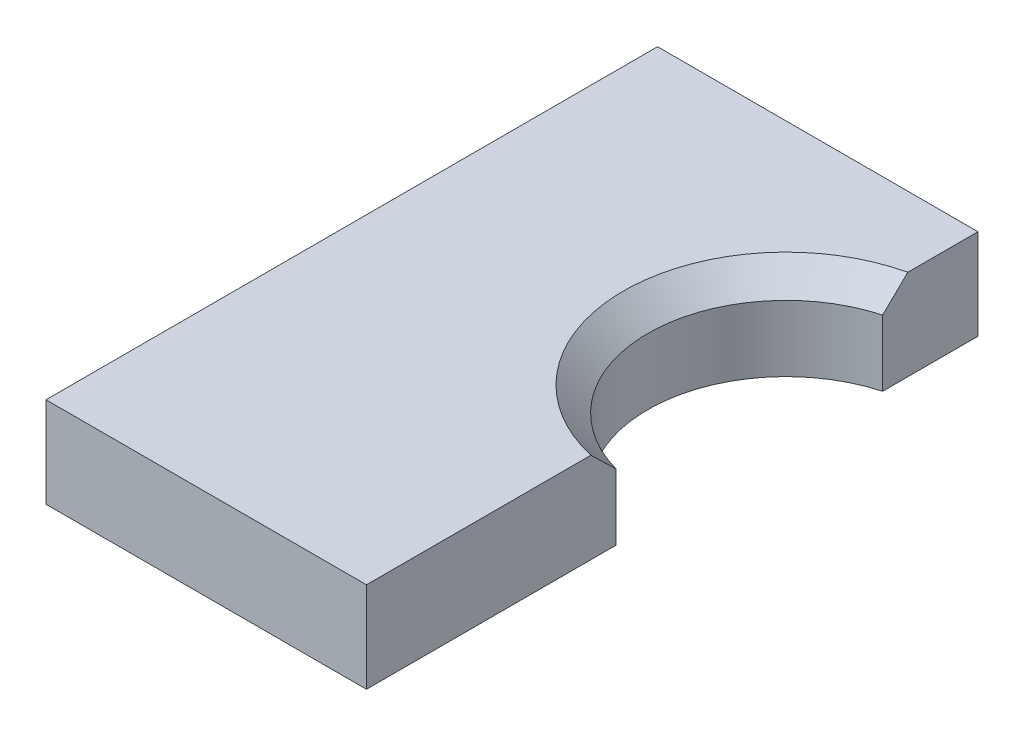
from build123d import *

# Parameters (mm, degrees)
BOSS_EXTRUDE1_DEPTH = 3.7
CHAMFER1_SIZE       = 1


with BuildPart() as part:
    # Sketch1 → Boss-Extrude1 (new body)
    with BuildSketch(Plane(origin=(0, 0, 0), x_dir=(1, 0, 0), z_dir=(0, 1, 0))):
        with BuildLine():
            Line((0, 28.997247011), (0, 4))
            Line((0, 4), (13.1, 4))
            Line((13.1, 4), (13.1, 14.202752989))
            ThreePointArc((13.1, 14.202752989), (8.95, 19.65), (13.1, 25.097247011))
            Line((13.1, 25.097247011), (13.1, 28.997247011))
            Line((13.1, 28.997247011), (0, 28.997247011))
        make_face()
    extrude(amount=BOSS_EXTRUDE1_DEPTH)

    # Chamfer1
    chamfer1_edges = [part.edges().sort_by_distance(p)[0] for p in [
        (8.95, 3.7, -19.65),
    ]]
    chamfer(chamfer1_edges, length=CHAMFER1_SIZE)


solid = part.part
